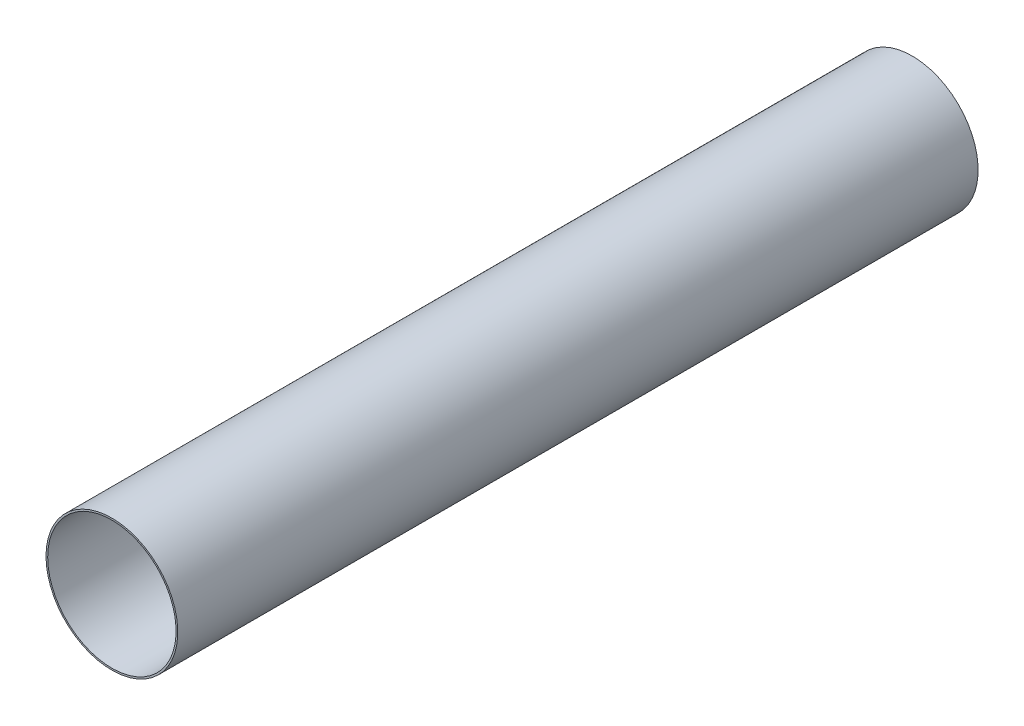
from build123d import *

# Parameters (mm, degrees)
SKETCH1_R           = 78.2
SKETCH1_R_2         = 76.2
BOSS_EXTRUDE1_DEPTH = 950


with BuildPart() as part:
    # Sketch1 → Boss-Extrude1 (new body)
    with BuildSketch(Plane.XY):
        with Locations(Location((0, 0, 0), (0, 0, 180))):
            Circle(SKETCH1_R)
        with Locations(Location((0, 0, 0), (0, 0, 180))):
            Circle(SKETCH1_R_2, mode=Mode.SUBTRACT)
    extrude(amount=BOSS_EXTRUDE1_DEPTH)


solid = part.part
